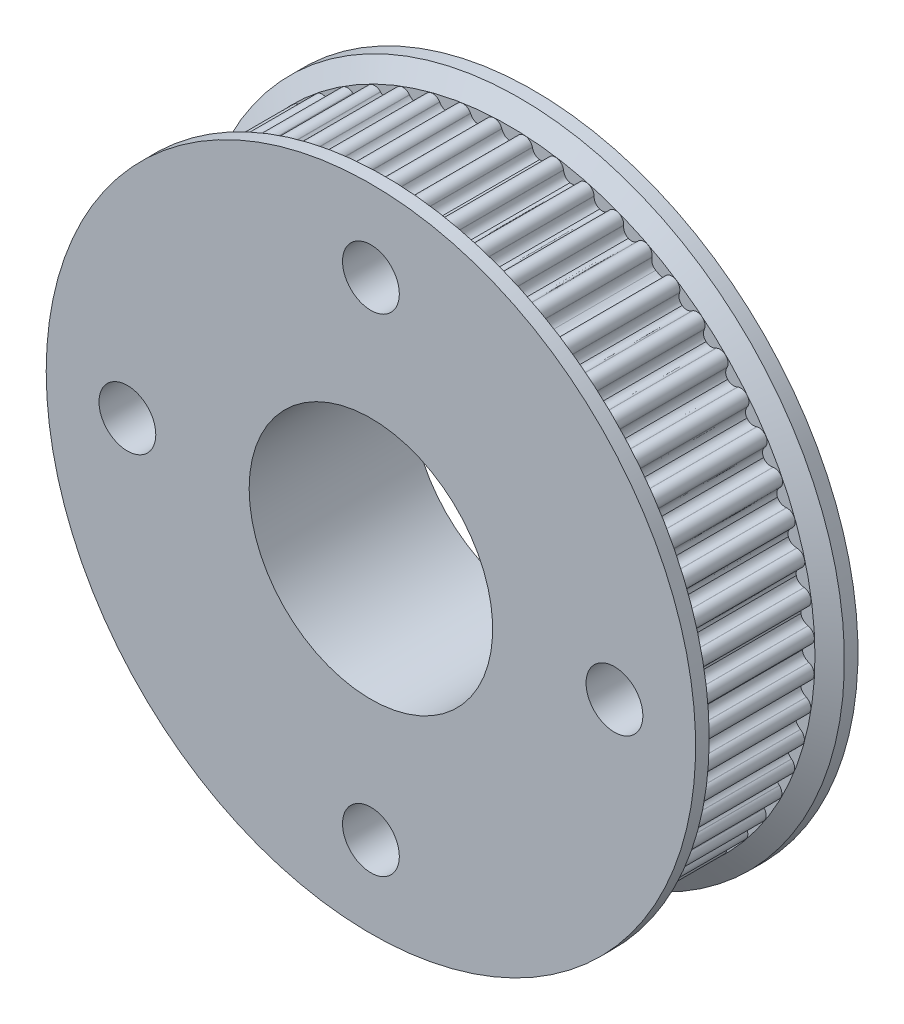
from build123d import *

# Parameters (mm, degrees)
SKETCH3_OUTSIDE_W  = 53.49
SKETCH3_OUTSIDE_H  = 53.49
CUT_EXTRUDE1_DEPTH = 7
SKETCH4_R          = 1.75
CUT_EXTRUDE2_DEPTH = 10
SKETCH5_R          = 3
CUT_EXTRUDE3_DEPTH = 3


with BuildPart() as part:
    # Sketch1 → Revolve1 (revolve)
    with BuildSketch(Plane(origin=(0, 0, 0), x_dir=(0, 0, -1), z_dir=(1, 0, 0)), mode=Mode.PRIVATE) as revolve1_sk:
        Polygon((0, 7.5), (0, 18.314101615), (0, 20), (-0.83604719, 20), (-1.5, 18.85), (-8.5, 18.85), (-9.16395281, 20), (-10, 20), (-10, 7.5), align=None)
    revolve(revolve1_sk.sketch.rotate(Axis((0, 0, 0), (0, 0, 1)), 90), axis=Axis((0, 0, 0), (0, 0, 1)))

    # Sketch3 outside → Cut-Extrude1 (cut)
    with BuildSketch(Plane.XY.offset(1.5)):
        Rectangle(SKETCH3_OUTSIDE_W, SKETCH3_OUTSIDE_H)
        with BuildLine():
            Line((0.48954913, 18.480375333), (0.485818632, 18.469717385))
            add(Edge.make_bspline(
                [(0.485818632, 18.469717385), (0.407741985, 18.249527558), (0.24028179, 18.086154527), (0.026214695, 18.085070307)],
                knots=[0, 0, 0, 0, 1, 1, 1, 1], degree=3))
            add(Edge.make_bspline(
                [(0.026214695, 18.085070307), (-0.187846082, 18.086775093), (-0.354832577, 18.250628249), (-0.432269829, 18.471041123)],
                knots=[0, 0, 0, 0, 1, 1, 1, 1], degree=3))
            Line((-0.432269829, 18.471041123), (-0.435971787, 18.481716895))
            ThreePointArc((-0.435971787, 18.481716895), (-0.931215069, 18.811965966), (-1.391421689, 18.434420969))
            Line((-1.391421689, 18.434420969), (-1.394049444, 18.423439012))
            add(Edge.make_bspline(
                [(-1.394049444, 18.423439012), (-1.451513615, 18.187532894), (-1.598236067, 18.015569009), (-1.838247448, 17.991333228)],
                knots=[0, 0, 0, 0, 1, 1, 1, 1], degree=3))
            add(Edge.make_bspline(
                [(-1.838247448, 17.991333228), (-2.078200755, 17.966529071), (-2.256668862, 18.105266918), (-2.36065454, 18.324677051)],
                knots=[0, 0, 0, 0, 1, 1, 1, 1], degree=3))
            Line((-2.36065454, 18.324677051), (-2.365448953, 18.334900655))
            ThreePointArc((-2.365448953, 18.334900655), (-2.892499669, 18.611573568), (-3.310721031, 18.187992112))
            Line((-3.310721031, 18.187992112), (-3.312186463, 18.176795639))
            add(Edge.make_bspline(
                [(-3.312186463, 18.176795639), (-3.344676936, 17.936175198), (-3.472620506, 17.749816677), (-3.70878375, 17.700625641)],
                knots=[0, 0, 0, 0, 1, 1, 1, 1], degree=3))
            add(Edge.make_bspline(
                [(-3.70878375, 17.700625641), (-3.944829828, 17.650875413), (-4.136822322, 17.770198244), (-4.26317296, 17.977536961)],
                knots=[0, 0, 0, 0, 1, 1, 1, 1], degree=3))
            Line((-4.26317296, 17.977536961), (-4.269009766, 17.987203407))
            ThreePointArc((-4.269009766, 17.987203407), (-4.822093437, 18.207268875), (-5.19374742, 17.742291806))
            Line((-5.19374742, 17.742291806), (-5.194034475, 17.73100349))
            add(Edge.make_bspline(
                [(-5.194034475, 17.73100349), (-5.201195276, 17.488305014), (-5.308958188, 17.289593639), (-5.538685842, 17.215986296)],
                knots=[0, 0, 0, 0, 1, 1, 1, 1], degree=3))
            add(Edge.make_bspline(
                [(-5.538685842, 17.215986296), (-5.76823852, 17.141835071), (-5.971651891, 17.240435558), (-6.118983164, 17.433431215)],
                knots=[0, 0, 0, 0, 1, 1, 1, 1], degree=3))
            Line((-6.118983164, 17.433431215), (-6.125798415, 17.442434594))
            ThreePointArc((-6.125798415, 17.442434594), (-6.698855341, 17.603481534), (-7.019870025, 17.102203239))
            Line((-7.019870025, 17.102203239), (-7.018975557, 17.090946756))
            add(Edge.make_bspline(
                [(-7.018975557, 17.090946756), (-7.000728232, 16.848829299), (-7.087129813, 16.639942195), (-7.307904932, 16.542725002)],
                knots=[0, 0, 0, 0, 1, 1, 1, 1], degree=3))
            add(Edge.make_bspline(
                [(-7.307904932, 16.542725002), (-7.528449183, 16.444985197), (-7.741054792, 16.521783053), (-7.907752509, 16.698321148)],
                knots=[0, 0, 0, 0, 1, 1, 1, 1], degree=3))
            Line((-7.907752509, 16.698321148), (-7.915471534, 16.706562818))
            ThreePointArc((-7.915471534, 16.706562818), (-8.502223183, 16.806826766), (-8.769081466, 16.274739354))
            Line((-8.769081466, 16.274739354), (-8.767015275, 16.263638033))
            add(Edge.make_bspline(
                [(-8.767015275, 16.263638033), (-8.723559745, 16.024754286), (-8.787653361, 15.807980062), (-8.997057087, 15.688218151)],
                knots=[0, 0, 0, 0, 1, 1, 1, 1], degree=3))
            add(Edge.make_bspline(
                [(-8.997057087, 15.688218151), (-9.206176582, 15.567960623), (-9.425645077, 15.622114435), (-9.609882862, 15.78026078)],
                knots=[0, 0, 0, 0, 1, 1, 1, 1], degree=3))
            Line((-9.609882862, 15.78026078), (-9.61842109, 15.787650443))
            ThreePointArc((-9.61842109, 15.787650443), (-10.212438889, 15.826032887), (-10.422217015, 15.268966019))
            Line((-10.422217015, 15.268966019), (-10.419001739, 15.258141488))
            add(Edge.make_bspline(
                [(-10.419001739, 15.258141488), (-10.350814112, 15.025108711), (-10.391897539, 14.802822392), (-10.587635602, 14.6618279)],
                knots=[0, 0, 0, 0, 1, 1, 1, 1], degree=3))
            add(Edge.make_bspline(
                [(-10.587635602, 14.6618279), (-10.783039184, 14.520370216), (-11.006966022, 14.551286663), (-11.206725327, 14.689308572)],
                knots=[0, 0, 0, 0, 1, 1, 1, 1], degree=3))
            Line((-11.206725327, 14.689308572), (-11.215989213, 14.695765267))
            ThreePointArc((-11.215989213, 14.695765267), (-11.810764978, 14.671845679), (-11.961164573, 14.095902697))
            Line((-11.961164573, 14.095902697), (-11.956835439, 14.085473551))
            add(Edge.make_bspline(
                [(-11.956835439, 14.085473551), (-11.864662793, 13.8608449), (-11.882285914, 13.635481902), (-12.062213765, 13.474799593)],
                knots=[0, 0, 0, 0, 1, 1, 1, 1], degree=3))
            add(Edge.make_bspline(
                [(-12.062213765, 13.474799593), (-12.241760551, 13.313691593), (-12.467692344, 13.321031948), (-12.680784565, 13.437417226)],
                knots=[0, 0, 0, 0, 1, 1, 1, 1], degree=3))
            Line((-12.680784565, 13.437417226), (-12.69067261, 13.442870211))
            ThreePointArc((-12.69067261, 13.442870211), (-13.279689854, 13.356910661), (-13.36906311, 12.768401715))
            Line((-13.36906311, 12.768401715), (-13.363667548, 12.75848222))
            add(Edge.make_bspline(
                [(-13.363667548, 12.75848222), (-13.248519746, 12.544718773), (-13.242489477, 12.318748218), (-13.404635791, 12.140138563)],
                knots=[0, 0, 0, 0, 1, 1, 1, 1], degree=3))
            add(Edge.make_bspline(
                [(-13.404635791, 12.140138563), (-13.566358629, 11.961145379), (-13.791820019, 11.94482922), (-14.015910473, 12.038302725)],
                knots=[0, 0, 0, 0, 1, 1, 1, 1], degree=3))
            Line((-14.015910473, 12.038302725), (-14.026314343, 12.042692255))
            ThreePointArc((-14.026314343, 12.042692255), (-14.603119668, 11.895634533), (-14.630487393, 11.301007453))
            Line((-14.630487393, 11.301007453), (-14.624084519, 11.291706287))
            add(Edge.make_bspline(
                [(-14.624084519, 11.291706287), (-14.487223144, 11.091150081), (-14.457605555, 10.867047752), (-14.600193821, 10.672467633)],
                knots=[0, 0, 0, 0, 1, 1, 1, 1], degree=3))
            add(Edge.make_bspline(
                [(-14.600193821, 10.672467633), (-14.742320842, 10.477550354), (-14.964841628, 10.437756444), (-15.197475133, 10.50729406)],
                knots=[0, 0, 0, 0, 1, 1, 1, 1], degree=3))
            Line((-15.197475133, 10.50729406), (-15.20828084, 10.510572043))
            ThreePointArc((-15.20828084, 10.510572043), (-15.766554648, 10.304027345), (-15.731616994, 9.709796987))
            Line((-15.731616994, 9.709796987), (-15.72427696, 9.701216057))
            add(Edge.make_bspline(
                [(-15.72427696, 9.701216057), (-15.567201493, 9.516064428), (-15.514321081, 9.296285636), (-15.635789073, 9.087866916)],
                knots=[0, 0, 0, 0, 1, 1, 1, 1], degree=3))
            add(Edge.make_bspline(
                [(-15.635789073, 9.087866916), (-15.756763103, 8.879161094), (-15.973905301, 8.816325423), (-16.212533075, 8.861165283)],
                knots=[0, 0, 0, 0, 1, 1, 1, 1], degree=3))
            Line((-16.212533075, 8.861165283), (-16.22362223, 8.863295805))
            ThreePointArc((-16.22362223, 8.863295805), (-16.757247956, 8.599527076), (-16.660387708, 8.012203954))
            Line((-16.660387708, 8.012203954), (-16.652190932, 8.004437273))
            add(Edge.make_bspline(
                [(-16.652190932, 8.004437273), (-16.476622326, 7.836718782), (-16.401058458, 7.623671469), (-16.500075347, 7.403697626)],
                knots=[0, 0, 0, 0, 1, 1, 1, 1], degree=3))
            add(Edge.make_bspline(
                [(-16.500075347, 7.403697626), (-16.598570971, 7.183489887), (-16.807955525, 7.098300897), (-17.049963113, 7.117951724)],
                knots=[0, 0, 0, 0, 1, 1, 1, 1], degree=3))
            Line((-17.049963113, 7.117951724), (-17.06121422, 7.118911443))
            ThreePointArc((-17.06121422, 7.118911443), (-17.564345349, 6.80080859), (-17.406623728, 6.226827538))
            Line((-17.406623728, 6.226827538), (-17.397660015, 6.2199602))
            add(Edge.make_bspline(
                [(-17.397660015, 6.2199602), (-17.205521836, 6.071512405), (-17.108102407, 5.867530763), (-17.183583343, 5.638411876)],
                knots=[0, 0, 0, 0, 1, 1, 1, 1], degree=3))
            add(Edge.make_bspline(
                [(-17.183583343, 5.638411876), (-17.258521421, 5.409114862), (-17.45785427, 5.3025059), (-17.700590186, 5.296752397)],
                knots=[0, 0, 0, 0, 1, 1, 1, 1], degree=3))
            Line((-17.700590186, 5.296752397), (-17.711879977, 5.296530797))
            ThreePointArc((-17.711879977, 5.296530797), (-18.179004098, 4.927579021), (-17.962149135, 4.373228696))
            Line((-17.962149135, 4.373228696), (-17.952516694, 4.367335942))
            add(Edge.make_bspline(
                [(-17.952516694, 4.367335942), (-17.745914049, 4.239785268), (-17.627706406, 4.047104161), (-17.678824405, 3.811350505)],
                knots=[0, 0, 0, 0, 1, 1, 1, 1], degree=3))
            add(Edge.make_bspline(
                [(-17.678824405, 3.811350505), (-17.729383899, 3.575476442), (-17.916481111, 3.448615539), (-18.157285889, 3.417520742)],
                knots=[0, 0, 0, 0, 1, 1, 1, 1], degree=3))
            Line((-18.157285889, 3.417520742), (-18.16849067, 3.416120252))
            ThreePointArc((-18.16849067, 3.416120252), (-18.594489874, 3.000361866), (-18.320877478, 2.471715846))
            Line((-18.320877478, 2.471715846), (-18.310681844, 2.466862237))
            add(Edge.make_bspline(
                [(-18.310681844, 2.466862237), (-18.091878313, 2.361606156), (-17.954177565, 2.18233664), (-17.980372566, 1.942531181)],
                knots=[0, 0, 0, 0, 1, 1, 1, 1], degree=3))
            add(Edge.make_bspline(
                [(-17.980372566, 1.942531181), (-18.005999537, 1.702664355), (-18.178811236, 1.556941425), (-18.415046569, 1.500846015)],
                knots=[0, 0, 0, 0, 1, 1, 1, 1], degree=3))
            Line((-18.415046569, 1.500846015), (-18.426043577, 1.498281978))
            ThreePointArc((-18.426043577, 1.498281978), (-18.806250528, 1.040272118), (-18.478878453, 0.543122359))
            Line((-18.478878453, 0.543122359), (-18.468231332, 0.539361073))
            add(Edge.make_bspline(
                [(-18.468231332, 0.539361073), (-18.239624173, 0.457552792), (-18.083938997, 0.293658981), (-18.084924003, 0.052429079)],
                knots=[0, 0, 0, 0, 1, 1, 1, 1], degree=3))
            add(Edge.make_bspline(
                [(-18.084924003, 0.052429079), (-18.085337676, -0.18880248), (-18.2419705, -0.351790866), (-18.471048144, -0.432272296)],
                knots=[0, 0, 0, 0, 1, 1, 1, 1], degree=3))
            Line((-18.471048144, -0.432272296), (-18.481716895, -0.435971787))
            ThreePointArc((-18.481716895, -0.435971787), (-18.811965966, -0.931215069), (-18.434420969, -1.391421689))
            Line((-18.434420969, -1.391421689), (-18.423439012, -1.394049444))
            add(Edge.make_bspline(
                [(-18.423439012, -1.394049444), (-18.187532894, -1.451513615), (-18.015569009, -1.598236067), (-17.991333228, -1.838247448)],
                knots=[0, 0, 0, 0, 1, 1, 1, 1], degree=3))
            add(Edge.make_bspline(
                [(-17.991333228, -1.838247448), (-17.966529071, -2.078200755), (-18.105266918, -2.256668862), (-18.324677051, -2.36065454)],
                knots=[0, 0, 0, 0, 1, 1, 1, 1], degree=3))
            Line((-18.324677051, -2.36065454), (-18.334900655, -2.365448953))
            ThreePointArc((-18.334900655, -2.365448953), (-18.611573568, -2.892499669), (-18.187992112, -3.310721031))
            Line((-18.187992112, -3.310721031), (-18.176795639, -3.312186463))
            add(Edge.make_bspline(
                [(-18.176795639, -3.312186463), (-17.936175198, -3.344676936), (-17.749816677, -3.472620506), (-17.700625641, -3.70878375)],
                knots=[0, 0, 0, 0, 1, 1, 1, 1], degree=3))
            add(Edge.make_bspline(
                [(-17.700625641, -3.70878375), (-17.650875413, -3.944829828), (-17.770198244, -4.136822322), (-17.977536961, -4.26317296)],
                knots=[0, 0, 0, 0, 1, 1, 1, 1], degree=3))
            Line((-17.977536961, -4.26317296), (-17.987203407, -4.269009766))
            ThreePointArc((-17.987203407, -4.269009766), (-18.207268875, -4.822093437), (-17.742291806, -5.19374742))
            Line((-17.742291806, -5.19374742), (-17.73100349, -5.194034475))
            add(Edge.make_bspline(
                [(-17.73100349, -5.194034475), (-17.488305014, -5.201195276), (-17.289593639, -5.308958188), (-17.215986296, -5.538685842)],
                knots=[0, 0, 0, 0, 1, 1, 1, 1], degree=3))
            add(Edge.make_bspline(
                [(-17.215986296, -5.538685842), (-17.141835071, -5.76823852), (-17.240435558, -5.971651891), (-17.433431215, -6.118983164)],
                knots=[0, 0, 0, 0, 1, 1, 1, 1], degree=3))
            Line((-17.433431215, -6.118983164), (-17.442434594, -6.125798415))
            ThreePointArc((-17.442434594, -6.125798415), (-17.603481534, -6.698855341), (-17.102203239, -7.019870025))
            Line((-17.102203239, -7.019870025), (-17.090946756, -7.018975557))
            add(Edge.make_bspline(
                [(-17.090946756, -7.018975557), (-16.848829299, -7.000728232), (-16.639942195, -7.087129813), (-16.542725002, -7.307904932)],
                knots=[0, 0, 0, 0, 1, 1, 1, 1], degree=3))
            add(Edge.make_bspline(
                [(-16.542725002, -7.307904932), (-16.444985197, -7.528449183), (-16.521783053, -7.741054792), (-16.698321148, -7.907752509)],
                knots=[0, 0, 0, 0, 1, 1, 1, 1], degree=3))
            Line((-16.698321148, -7.907752509), (-16.706562818, -7.915471534))
            ThreePointArc((-16.706562818, -7.915471534), (-16.806826766, -8.502223183), (-16.274739354, -8.769081466))
            Line((-16.274739354, -8.769081466), (-16.263638033, -8.767015275))
            add(Edge.make_bspline(
                [(-16.263638033, -8.767015275), (-16.024754286, -8.723559745), (-15.807980062, -8.787653361), (-15.688218151, -8.997057087)],
                knots=[0, 0, 0, 0, 1, 1, 1, 1], degree=3))
            add(Edge.make_bspline(
                [(-15.688218151, -8.997057087), (-15.567960623, -9.206176582), (-15.622114435, -9.425645077), (-15.78026078, -9.609882862)],
                knots=[0, 0, 0, 0, 1, 1, 1, 1], degree=3))
            Line((-15.78026078, -9.609882862), (-15.787650443, -9.61842109))
            ThreePointArc((-15.787650443, -9.61842109), (-15.826032887, -10.212438889), (-15.268966019, -10.422217015))
            Line((-15.268966019, -10.422217015), (-15.258141488, -10.419001739))
            add(Edge.make_bspline(
                [(-15.258141488, -10.419001739), (-15.025108711, -10.350814112), (-14.802822392, -10.391897539), (-14.6618279, -10.587635602)],
                knots=[0, 0, 0, 0, 1, 1, 1, 1], degree=3))
            add(Edge.make_bspline(
                [(-14.6618279, -10.587635602), (-14.520370216, -10.783039184), (-14.551286663, -11.006966022), (-14.689308572, -11.206725327)],
                knots=[0, 0, 0, 0, 1, 1, 1, 1], degree=3))
            Line((-14.689308572, -11.206725327), (-14.695765267, -11.215989213))
            ThreePointArc((-14.695765267, -11.215989213), (-14.671845679, -11.810764978), (-14.095902697, -11.961164573))
            Line((-14.095902697, -11.961164573), (-14.085473551, -11.956835439))
            add(Edge.make_bspline(
                [(-14.085473551, -11.956835439), (-13.8608449, -11.864662793), (-13.635481902, -11.882285914), (-13.474799593, -12.062213765)],
                knots=[0, 0, 0, 0, 1, 1, 1, 1], degree=3))
            add(Edge.make_bspline(
                [(-13.474799593, -12.062213765), (-13.313691593, -12.241760551), (-13.321031948, -12.467692344), (-13.437417226, -12.680784565)],
                knots=[0, 0, 0, 0, 1, 1, 1, 1], degree=3))
            Line((-13.437417226, -12.680784565), (-13.442870211, -12.69067261))
            ThreePointArc((-13.442870211, -12.69067261), (-13.356910661, -13.279689854), (-12.768401715, -13.36906311))
            Line((-12.768401715, -13.36906311), (-12.75848222, -13.363667548))
            add(Edge.make_bspline(
                [(-12.75848222, -13.363667548), (-12.544718773, -13.248519746), (-12.318748218, -13.242489477), (-12.140138563, -13.404635791)],
                knots=[0, 0, 0, 0, 1, 1, 1, 1], degree=3))
            add(Edge.make_bspline(
                [(-12.140138563, -13.404635791), (-11.961145379, -13.566358629), (-11.94482922, -13.791820019), (-12.038302725, -14.015910473)],
                knots=[0, 0, 0, 0, 1, 1, 1, 1], degree=3))
            Line((-12.038302725, -14.015910473), (-12.042692255, -14.026314343))
            ThreePointArc((-12.042692255, -14.026314343), (-11.895634533, -14.603119668), (-11.301007453, -14.630487393))
            Line((-11.301007453, -14.630487393), (-11.291706287, -14.624084519))
            add(Edge.make_bspline(
                [(-11.291706287, -14.624084519), (-11.091150081, -14.487223144), (-10.867047752, -14.457605555), (-10.672467633, -14.600193821)],
                knots=[0, 0, 0, 0, 1, 1, 1, 1], degree=3))
            add(Edge.make_bspline(
                [(-10.672467633, -14.600193821), (-10.477550354, -14.742320842), (-10.437756444, -14.964841628), (-10.50729406, -15.197475133)],
                knots=[0, 0, 0, 0, 1, 1, 1, 1], degree=3))
            Line((-10.50729406, -15.197475133), (-10.510572043, -15.20828084))
            ThreePointArc((-10.510572043, -15.20828084), (-10.304027345, -15.766554648), (-9.709796987, -15.731616994))
            Line((-9.709796987, -15.731616994), (-9.701216057, -15.72427696))
            add(Edge.make_bspline(
                [(-9.701216057, -15.72427696), (-9.516064428, -15.567201493), (-9.296285636, -15.514321081), (-9.087866916, -15.635789073)],
                knots=[0, 0, 0, 0, 1, 1, 1, 1], degree=3))
            add(Edge.make_bspline(
                [(-9.087866916, -15.635789073), (-8.879161094, -15.756763103), (-8.816325423, -15.973905301), (-8.861165283, -16.212533075)],
                knots=[0, 0, 0, 0, 1, 1, 1, 1], degree=3))
            Line((-8.861165283, -16.212533075), (-8.863295805, -16.22362223))
            ThreePointArc((-8.863295805, -16.22362223), (-8.599527076, -16.757247956), (-8.012203954, -16.660387708))
            Line((-8.012203954, -16.660387708), (-8.004437273, -16.652190932))
            add(Edge.make_bspline(
                [(-8.004437273, -16.652190932), (-7.836718782, -16.476622326), (-7.623671469, -16.401058458), (-7.403697626, -16.500075347)],
                knots=[0, 0, 0, 0, 1, 1, 1, 1], degree=3))
            add(Edge.make_bspline(
                [(-7.403697626, -16.500075347), (-7.183489887, -16.598570971), (-7.098300897, -16.807955525), (-7.117951724, -17.049963113)],
                knots=[0, 0, 0, 0, 1, 1, 1, 1], degree=3))
            Line((-7.117951724, -17.049963113), (-7.118911443, -17.06121422))
            ThreePointArc((-7.118911443, -17.06121422), (-6.80080859, -17.564345349), (-6.226827538, -17.406623728))
            Line((-6.226827538, -17.406623728), (-6.2199602, -17.397660015))
            add(Edge.make_bspline(
                [(-6.2199602, -17.397660015), (-6.071512405, -17.205521836), (-5.867530763, -17.108102407), (-5.638411876, -17.183583343)],
                knots=[0, 0, 0, 0, 1, 1, 1, 1], degree=3))
            add(Edge.make_bspline(
                [(-5.638411876, -17.183583343), (-5.409114862, -17.258521421), (-5.3025059, -17.45785427), (-5.296752397, -17.700590186)],
                knots=[0, 0, 0, 0, 1, 1, 1, 1], degree=3))
            Line((-5.296752397, -17.700590186), (-5.296530797, -17.711879977))
            ThreePointArc((-5.296530797, -17.711879977), (-4.927579021, -18.179004098), (-4.373228696, -17.962149135))
            Line((-4.373228696, -17.962149135), (-4.367335942, -17.952516694))
            add(Edge.make_bspline(
                [(-4.367335942, -17.952516694), (-4.239785268, -17.745914049), (-4.047104161, -17.627706406), (-3.811350505, -17.678824405)],
                knots=[0, 0, 0, 0, 1, 1, 1, 1], degree=3))
            add(Edge.make_bspline(
                [(-3.811350505, -17.678824405), (-3.575476442, -17.729383899), (-3.448615539, -17.916481111), (-3.417520742, -18.157285889)],
                knots=[0, 0, 0, 0, 1, 1, 1, 1], degree=3))
            Line((-3.417520742, -18.157285889), (-3.416120252, -18.16849067))
            ThreePointArc((-3.416120252, -18.16849067), (-3.000361866, -18.594489874), (-2.471715846, -18.320877478))
            Line((-2.471715846, -18.320877478), (-2.466862237, -18.310681844))
            add(Edge.make_bspline(
                [(-2.466862237, -18.310681844), (-2.361606156, -18.091878313), (-2.18233664, -17.954177565), (-1.942531181, -17.980372566)],
                knots=[0, 0, 0, 0, 1, 1, 1, 1], degree=3))
            add(Edge.make_bspline(
                [(-1.942531181, -17.980372566), (-1.702664355, -18.005999537), (-1.556941425, -18.178811236), (-1.500846015, -18.415046569)],
                knots=[0, 0, 0, 0, 1, 1, 1, 1], degree=3))
            Line((-1.500846015, -18.415046569), (-1.498281978, -18.426043577))
            ThreePointArc((-1.498281978, -18.426043577), (-1.040272118, -18.806250528), (-0.543122359, -18.478878453))
            Line((-0.543122359, -18.478878453), (-0.539361073, -18.468231332))
            add(Edge.make_bspline(
                [(-0.539361073, -18.468231332), (-0.457552792, -18.239624173), (-0.293658981, -18.083938997), (-0.052429079, -18.084924003)],
                knots=[0, 0, 0, 0, 1, 1, 1, 1], degree=3))
            add(Edge.make_bspline(
                [(-0.052429079, -18.084924003), (0.18880248, -18.085337676), (0.351790866, -18.2419705), (0.432272296, -18.471048144)],
                knots=[0, 0, 0, 0, 1, 1, 1, 1], degree=3))
            Line((0.432272296, -18.471048144), (0.435971787, -18.481716895))
            ThreePointArc((0.435971787, -18.481716895), (0.931215069, -18.811965966), (1.391421689, -18.434420969))
            Line((1.391421689, -18.434420969), (1.39404954, -18.423439036))
            add(Edge.make_bspline(
                [(1.39404954, -18.423439036), (1.451513615, -18.187532894), (1.598236067, -18.015569009), (1.838247448, -17.991333228)],
                knots=[0, 0, 0, 0, 1, 1, 1, 1], degree=3))
            add(Edge.make_bspline(
                [(1.838247448, -17.991333228), (2.078200755, -17.966529071), (2.256668862, -18.105266919), (2.36065454, -18.324677051)],
                knots=[0, 0, 0, 0, 1, 1, 1, 1], degree=3))
            Line((2.36065454, -18.324677051), (2.365448953, -18.334900655))
            ThreePointArc((2.365448953, -18.334900655), (2.892499669, -18.611573568), (3.310721031, -18.187992112))
            Line((3.310721031, -18.187992112), (3.312186562, -18.176795653))
            add(Edge.make_bspline(
                [(3.312186562, -18.176795653), (3.344676936, -17.936175198), (3.472620506, -17.749816677), (3.70878375, -17.700625641)],
                knots=[0, 0, 0, 0, 1, 1, 1, 1], degree=3))
            add(Edge.make_bspline(
                [(3.70878375, -17.700625641), (3.944829828, -17.650875413), (4.136822322, -17.770198244), (4.26317296, -17.977536961)],
                knots=[0, 0, 0, 0, 1, 1, 1, 1], degree=3))
            Line((4.26317296, -17.977536961), (4.269009766, -17.987203407))
            ThreePointArc((4.269009766, -17.987203407), (4.822093437, -18.207268875), (5.19374742, -17.742291806))
            Line((5.19374742, -17.742291806), (5.194034574, -17.731003493))
            add(Edge.make_bspline(
                [(5.194034574, -17.731003493), (5.201195276, -17.488305013), (5.308958188, -17.289593639), (5.538685842, -17.215986296)],
                knots=[0, 0, 0, 0, 1, 1, 1, 1], degree=3))
            add(Edge.make_bspline(
                [(5.538685842, -17.215986296), (5.76823852, -17.141835071), (5.971651891, -17.240435558), (6.118983164, -17.433431215)],
                knots=[0, 0, 0, 0, 1, 1, 1, 1], degree=3))
            Line((6.118983164, -17.433431215), (6.125798415, -17.442434594))
            ThreePointArc((6.125798415, -17.442434594), (6.698855341, -17.603481534), (7.019870025, -17.102203239))
            Line((7.019870025, -17.102203239), (7.018975656, -17.090946748))
            add(Edge.make_bspline(
                [(7.018975656, -17.090946748), (7.000728232, -16.848829299), (7.087129813, -16.639942195), (7.307904932, -16.542725002)],
                knots=[0, 0, 0, 0, 1, 1, 1, 1], degree=3))
            add(Edge.make_bspline(
                [(7.307904932, -16.542725002), (7.528449183, -16.444985197), (7.741054792, -16.521783053), (7.907752509, -16.698321148)],
                knots=[0, 0, 0, 0, 1, 1, 1, 1], degree=3))
            Line((7.907752509, -16.698321148), (7.915471534, -16.706562818))
            ThreePointArc((7.915471534, -16.706562818), (8.502223183, -16.806826766), (8.769081466, -16.274739354))
            Line((8.769081466, -16.274739354), (8.767015373, -16.263638015))
            add(Edge.make_bspline(
                [(8.767015373, -16.263638015), (8.723559745, -16.024754286), (8.787653361, -15.807980062), (8.997057087, -15.688218151)],
                knots=[0, 0, 0, 0, 1, 1, 1, 1], degree=3))
            add(Edge.make_bspline(
                [(8.997057087, -15.688218151), (9.206176582, -15.567960623), (9.425645077, -15.622114435), (9.609882862, -15.78026078)],
                knots=[0, 0, 0, 0, 1, 1, 1, 1], degree=3))
            Line((9.609882862, -15.78026078), (9.61842109, -15.787650443))
            ThreePointArc((9.61842109, -15.787650443), (10.212438889, -15.826032887), (10.422217015, -15.268966019))
            Line((10.422217015, -15.268966019), (10.419001834, -15.25814146))
            add(Edge.make_bspline(
                [(10.419001834, -15.25814146), (10.350814112, -15.025108711), (10.391897539, -14.802822392), (10.587635602, -14.6618279)],
                knots=[0, 0, 0, 0, 1, 1, 1, 1], degree=3))
            add(Edge.make_bspline(
                [(10.587635602, -14.6618279), (10.783039184, -14.520370216), (11.006966022, -14.551286663), (11.206725327, -14.689308572)],
                knots=[0, 0, 0, 0, 1, 1, 1, 1], degree=3))
            Line((11.206725327, -14.689308572), (11.215989213, -14.695765267))
            ThreePointArc((11.215989213, -14.695765267), (11.810764978, -14.671845679), (11.961164573, -14.095902697))
            Line((11.961164573, -14.095902697), (11.956835531, -14.085473514))
            add(Edge.make_bspline(
                [(11.956835531, -14.085473514), (11.864662793, -13.8608449), (11.882285914, -13.635481902), (12.062213765, -13.474799593)],
                knots=[0, 0, 0, 0, 1, 1, 1, 1], degree=3))
            add(Edge.make_bspline(
                [(12.062213765, -13.474799593), (12.241760551, -13.313691593), (12.467692344, -13.321031948), (12.680784565, -13.437417226)],
                knots=[0, 0, 0, 0, 1, 1, 1, 1], degree=3))
            Line((12.680784565, -13.437417226), (12.69067261, -13.442870211))
            ThreePointArc((12.69067261, -13.442870211), (13.279689854, -13.356910661), (13.36906311, -12.768401715))
            Line((13.36906311, -12.768401715), (13.363667636, -12.758482173))
            add(Edge.make_bspline(
                [(13.363667636, -12.758482173), (13.248519746, -12.544718773), (13.242489477, -12.318748218), (13.404635791, -12.140138563)],
                knots=[0, 0, 0, 0, 1, 1, 1, 1], degree=3))
            add(Edge.make_bspline(
                [(13.404635791, -12.140138563), (13.566358629, -11.961145379), (13.791820019, -11.94482922), (14.015910473, -12.038302725)],
                knots=[0, 0, 0, 0, 1, 1, 1, 1], degree=3))
            Line((14.015910473, -12.038302725), (14.026314343, -12.042692255))
            ThreePointArc((14.026314343, -12.042692255), (14.603119668, -11.895634533), (14.630487393, -11.301007453))
            Line((14.630487393, -11.301007453), (14.624084601, -11.291706231))
            add(Edge.make_bspline(
                [(14.624084601, -11.291706231), (14.487223144, -11.091150081), (14.457605555, -10.867047752), (14.600193821, -10.672467633)],
                knots=[0, 0, 0, 0, 1, 1, 1, 1], degree=3))
            add(Edge.make_bspline(
                [(14.600193821, -10.672467633), (14.742320842, -10.477550354), (14.964841628, -10.437756444), (15.197475133, -10.50729406)],
                knots=[0, 0, 0, 0, 1, 1, 1, 1], degree=3))
            Line((15.197475133, -10.50729406), (15.20828084, -10.510572043))
            ThreePointArc((15.20828084, -10.510572043), (15.766554648, -10.304027345), (15.731616994, -9.709796987))
            Line((15.731616994, -9.709796987), (15.724277035, -9.701215992))
            add(Edge.make_bspline(
                [(15.724277035, -9.701215992), (15.567201493, -9.516064428), (15.514321081, -9.296285636), (15.635789073, -9.087866916)],
                knots=[0, 0, 0, 0, 1, 1, 1, 1], degree=3))
            add(Edge.make_bspline(
                [(15.635789073, -9.087866916), (15.756763103, -8.879161094), (15.973905301, -8.816325423), (16.212533075, -8.861165283)],
                knots=[0, 0, 0, 0, 1, 1, 1, 1], degree=3))
            Line((16.212533075, -8.861165283), (16.22362223, -8.863295805))
            ThreePointArc((16.22362223, -8.863295805), (16.757247956, -8.599527076), (16.660387708, -8.012203954))
            Line((16.660387708, -8.012203954), (16.652191, -8.004437202))
            add(Edge.make_bspline(
                [(16.652191, -8.004437202), (16.476622326, -7.836718782), (16.401058458, -7.623671469), (16.500075347, -7.403697626)],
                knots=[0, 0, 0, 0, 1, 1, 1, 1], degree=3))
            add(Edge.make_bspline(
                [(16.500075347, -7.403697626), (16.598570971, -7.183489887), (16.807955525, -7.098300897), (17.049963113, -7.117951724)],
                knots=[0, 0, 0, 0, 1, 1, 1, 1], degree=3))
            Line((17.049963113, -7.117951724), (17.06121422, -7.118911443))
            ThreePointArc((17.06121422, -7.118911443), (17.564345349, -6.80080859), (17.406623728, -6.226827538))
            Line((17.406623728, -6.226827538), (17.397660075, -6.219960122))
            add(Edge.make_bspline(
                [(17.397660075, -6.219960122), (17.205521836, -6.071512405), (17.108102407, -5.867530763), (17.183583343, -5.638411876)],
                knots=[0, 0, 0, 0, 1, 1, 1, 1], degree=3))
            add(Edge.make_bspline(
                [(17.183583343, -5.638411876), (17.258521421, -5.409114862), (17.45785427, -5.3025059), (17.700590186, -5.296752397)],
                knots=[0, 0, 0, 0, 1, 1, 1, 1], degree=3))
            Line((17.700590186, -5.296752397), (17.711879977, -5.296530797))
            ThreePointArc((17.711879977, -5.296530797), (18.179004098, -4.927579021), (17.962149135, -4.373228696))
            Line((17.962149135, -4.373228696), (17.952516746, -4.367335857))
            add(Edge.make_bspline(
                [(17.952516746, -4.367335857), (17.745914049, -4.239785268), (17.627706406, -4.047104161), (17.678824405, -3.811350505)],
                knots=[0, 0, 0, 0, 1, 1, 1, 1], degree=3))
            add(Edge.make_bspline(
                [(17.678824405, -3.811350505), (17.729383899, -3.575476442), (17.916481111, -3.448615539), (18.157285889, -3.417520742)],
                knots=[0, 0, 0, 0, 1, 1, 1, 1], degree=3))
            Line((18.157285889, -3.417520742), (18.16849067, -3.416120252))
            ThreePointArc((18.16849067, -3.416120252), (18.594489874, -3.000361866), (18.320877478, -2.471715846))
            Line((18.320877478, -2.471715846), (18.310681887, -2.466862147))
            add(Edge.make_bspline(
                [(18.310681887, -2.466862147), (18.091878313, -2.361606156), (17.954177565, -2.18233664), (17.980372566, -1.942531181)],
                knots=[0, 0, 0, 0, 1, 1, 1, 1], degree=3))
            add(Edge.make_bspline(
                [(17.980372566, -1.942531181), (18.005999537, -1.702664355), (18.178811236, -1.556941425), (18.415046569, -1.500846015)],
                knots=[0, 0, 0, 0, 1, 1, 1, 1], degree=3))
            Line((18.415046569, -1.500846015), (18.426043577, -1.498281978))
            ThreePointArc((18.426043577, -1.498281978), (18.806250528, -1.040272118), (18.478878453, -0.543122359))
            Line((18.478878453, -0.543122359), (18.468231365, -0.539360979))
            add(Edge.make_bspline(
                [(18.468231365, -0.539360979), (18.239624173, -0.457552792), (18.083938997, -0.293658981), (18.084924003, -0.052429079)],
                knots=[0, 0, 0, 0, 1, 1, 1, 1], degree=3))
            add(Edge.make_bspline(
                [(18.084924003, -0.052429079), (18.085337676, 0.18880248), (18.2419705, 0.351790866), (18.471048144, 0.432272296)],
                knots=[0, 0, 0, 0, 1, 1, 1, 1], degree=3))
            Line((18.471048144, 0.432272296), (18.481716895, 0.435971787))
            ThreePointArc((18.481716895, 0.435971787), (18.811965966, 0.931215069), (18.434420969, 1.391421689))
            Line((18.434420969, 1.391421689), (18.423439036, 1.39404954))
            add(Edge.make_bspline(
                [(18.423439036, 1.39404954), (18.187532894, 1.451513615), (18.015569009, 1.598236067), (17.991333228, 1.838247448)],
                knots=[0, 0, 0, 0, 1, 1, 1, 1], degree=3))
            add(Edge.make_bspline(
                [(17.991333228, 1.838247448), (17.966529071, 2.078200755), (18.105266919, 2.256668862), (18.324677051, 2.36065454)],
                knots=[0, 0, 0, 0, 1, 1, 1, 1], degree=3))
            Line((18.324677051, 2.36065454), (18.334900655, 2.365448953))
            ThreePointArc((18.334900655, 2.365448953), (18.611573568, 2.892499669), (18.187992112, 3.310721031))
            Line((18.187992112, 3.310721031), (18.176795653, 3.312186562))
            add(Edge.make_bspline(
                [(18.176795653, 3.312186562), (17.936175198, 3.344676936), (17.749816677, 3.472620506), (17.700625641, 3.70878375)],
                knots=[0, 0, 0, 0, 1, 1, 1, 1], degree=3))
            add(Edge.make_bspline(
                [(17.700625641, 3.70878375), (17.650875413, 3.944829828), (17.770198244, 4.136822322), (17.977536961, 4.26317296)],
                knots=[0, 0, 0, 0, 1, 1, 1, 1], degree=3))
            Line((17.977536961, 4.26317296), (17.987203407, 4.269009766))
            ThreePointArc((17.987203407, 4.269009766), (18.207268875, 4.822093437), (17.742291806, 5.19374742))
            Line((17.742291806, 5.19374742), (17.731003493, 5.194034574))
            add(Edge.make_bspline(
                [(17.731003493, 5.194034574), (17.488305013, 5.201195276), (17.289593639, 5.308958188), (17.215986296, 5.538685842)],
                knots=[0, 0, 0, 0, 1, 1, 1, 1], degree=3))
            add(Edge.make_bspline(
                [(17.215986296, 5.538685842), (17.141835071, 5.76823852), (17.240435558, 5.971651891), (17.433431215, 6.118983164)],
                knots=[0, 0, 0, 0, 1, 1, 1, 1], degree=3))
            Line((17.433431215, 6.118983164), (17.442434594, 6.125798415))
            ThreePointArc((17.442434594, 6.125798415), (17.603481534, 6.698855341), (17.102203239, 7.019870025))
            Line((17.102203239, 7.019870025), (17.090946748, 7.018975656))
            add(Edge.make_bspline(
                [(17.090946748, 7.018975656), (16.848829299, 7.000728232), (16.639942195, 7.087129813), (16.542725002, 7.307904932)],
                knots=[0, 0, 0, 0, 1, 1, 1, 1], degree=3))
            add(Edge.make_bspline(
                [(16.542725002, 7.307904932), (16.444985197, 7.528449183), (16.521783053, 7.741054792), (16.698321148, 7.907752509)],
                knots=[0, 0, 0, 0, 1, 1, 1, 1], degree=3))
            Line((16.698321148, 7.907752509), (16.706562818, 7.915471534))
            ThreePointArc((16.706562818, 7.915471534), (16.806826766, 8.502223183), (16.274739354, 8.769081466))
            Line((16.274739354, 8.769081466), (16.263638015, 8.767015373))
            add(Edge.make_bspline(
                [(16.263638015, 8.767015373), (16.024754286, 8.723559745), (15.807980062, 8.787653361), (15.688218151, 8.997057087)],
                knots=[0, 0, 0, 0, 1, 1, 1, 1], degree=3))
            add(Edge.make_bspline(
                [(15.688218151, 8.997057087), (15.567960623, 9.206176582), (15.622114435, 9.425645077), (15.78026078, 9.609882862)],
                knots=[0, 0, 0, 0, 1, 1, 1, 1], degree=3))
            Line((15.78026078, 9.609882862), (15.787650443, 9.61842109))
            ThreePointArc((15.787650443, 9.61842109), (15.826032887, 10.212438889), (15.268966019, 10.422217015))
            Line((15.268966019, 10.422217015), (15.25814146, 10.419001834))
            add(Edge.make_bspline(
                [(15.25814146, 10.419001834), (15.025108711, 10.350814112), (14.802822392, 10.391897539), (14.6618279, 10.587635602)],
                knots=[0, 0, 0, 0, 1, 1, 1, 1], degree=3))
            add(Edge.make_bspline(
                [(14.6618279, 10.587635602), (14.520370216, 10.783039184), (14.551286663, 11.006966022), (14.689308572, 11.206725327)],
                knots=[0, 0, 0, 0, 1, 1, 1, 1], degree=3))
            Line((14.689308572, 11.206725327), (14.695765267, 11.215989213))
            ThreePointArc((14.695765267, 11.215989213), (14.671845679, 11.810764978), (14.095902697, 11.961164573))
            Line((14.095902697, 11.961164573), (14.085473514, 11.956835531))
            add(Edge.make_bspline(
                [(14.085473514, 11.956835531), (13.8608449, 11.864662793), (13.635481902, 11.882285914), (13.474799593, 12.062213765)],
                knots=[0, 0, 0, 0, 1, 1, 1, 1], degree=3))
            add(Edge.make_bspline(
                [(13.474799593, 12.062213765), (13.313691593, 12.241760551), (13.321031948, 12.467692344), (13.437417226, 12.680784565)],
                knots=[0, 0, 0, 0, 1, 1, 1, 1], degree=3))
            Line((13.437417226, 12.680784565), (13.442870211, 12.69067261))
            ThreePointArc((13.442870211, 12.69067261), (13.356910661, 13.279689854), (12.768401715, 13.36906311))
            Line((12.768401715, 13.36906311), (12.758482173, 13.363667636))
            add(Edge.make_bspline(
                [(12.758482173, 13.363667636), (12.544718773, 13.248519746), (12.318748218, 13.242489477), (12.140138563, 13.404635791)],
                knots=[0, 0, 0, 0, 1, 1, 1, 1], degree=3))
            add(Edge.make_bspline(
                [(12.140138563, 13.404635791), (11.961145379, 13.566358629), (11.94482922, 13.791820019), (12.038302725, 14.015910473)],
                knots=[0, 0, 0, 0, 1, 1, 1, 1], degree=3))
            Line((12.038302725, 14.015910473), (12.042692255, 14.026314343))
            ThreePointArc((12.042692255, 14.026314343), (11.895634533, 14.603119668), (11.301007453, 14.630487393))
            Line((11.301007453, 14.630487393), (11.291706231, 14.624084601))
            add(Edge.make_bspline(
                [(11.291706231, 14.624084601), (11.091150081, 14.487223144), (10.867047752, 14.457605555), (10.672467633, 14.600193821)],
                knots=[0, 0, 0, 0, 1, 1, 1, 1], degree=3))
            add(Edge.make_bspline(
                [(10.672467633, 14.600193821), (10.477550354, 14.742320842), (10.437756444, 14.964841628), (10.50729406, 15.197475133)],
                knots=[0, 0, 0, 0, 1, 1, 1, 1], degree=3))
            Line((10.50729406, 15.197475133), (10.510572043, 15.20828084))
            ThreePointArc((10.510572043, 15.20828084), (10.304027345, 15.766554648), (9.709796987, 15.731616994))
            Line((9.709796987, 15.731616994), (9.701215992, 15.724277035))
            add(Edge.make_bspline(
                [(9.701215992, 15.724277035), (9.516064428, 15.567201493), (9.599334459, 15.33876957), (9.0425, 15.662069427)],
                knots=[0, 0, 0, 0, 1, 1, 1, 1], degree=3))
            add(Edge.make_bspline(
                [(9.0425, 15.662069427), (8.833444347, 15.782437904), (8.769979438, 15.999397026), (8.814127318, 16.23815379)],
                knots=[0, 0, 0, 0, 1, 1, 1, 1], degree=3))
            Line((8.814127318, 16.23815379), (8.816225683, 16.249249075))
            ThreePointArc((8.816225683, 16.249249075), (8.550911063, 16.782107883), (7.96387121, 16.683545371))
            Line((7.96387121, 16.683545371), (7.956128252, 16.675326181))
            add(Edge.make_bspline(
                [(7.956128252, 16.675326181), (7.788919518, 16.499272023), (7.576092163, 16.423090841), (7.35583219, 16.521469601)],
                knots=[0, 0, 0, 0, 1, 1, 1, 1], degree=3))
            add(Edge.make_bspline(
                [(7.35583219, 16.521469601), (7.135339834, 16.619326421), (7.049544188, 16.828463129), (7.068493344, 17.070526668)],
                knots=[0, 0, 0, 0, 1, 1, 1, 1], degree=3))
            Line((7.068493344, 17.070526668), (7.069420441, 17.081780511))
            ThreePointArc((7.069420441, 17.081780511), (6.74986033, 17.583987333), (6.176338931, 17.424602383))
            Line((6.176338931, 17.424602383), (6.169497529, 17.415618859))
            add(Edge.make_bspline(
                [(6.169497529, 17.415618859), (6.021607452, 17.223051072), (5.817909089, 17.125040702), (5.588572343, 17.199857097)],
                knots=[0, 0, 0, 0, 1, 1, 1, 1], degree=3))
            add(Edge.make_bspline(
                [(5.588572343, 17.199857097), (5.359059045, 17.274130119), (5.251872657, 17.473153068), (5.245415478, 17.715871284)],
                knots=[0, 0, 0, 0, 1, 1, 1, 1], degree=3))
            Line((5.245415478, 17.715871284), (5.24516115, 17.727160385))
            ThreePointArc((5.24516115, 17.727160385), (4.874856715, 18.193212938), (4.32113739, 17.974751805))
            Line((4.32113739, 17.974751805), (4.3152725, 17.965102373))
            add(Edge.make_bspline(
                [(4.3152725, 17.965102373), (4.188321395, 17.75813077), (3.995983787, 17.639365034), (3.760082928, 17.689799359)],
                knots=[0, 0, 0, 0, 1, 1, 1, 1], degree=3))
            add(Edge.make_bspline(
                [(3.760082928, 17.689799359), (3.524063283, 17.739674834), (3.396660511, 17.926403485), (3.364867742, 18.167117107)],
                knots=[0, 0, 0, 0, 1, 1, 1, 1], degree=3))
            Line((3.364867742, 18.167117107), (3.363434775, 18.17831778))
            ThreePointArc((3.363434775, 18.17831778), (2.946443149, 18.603109895), (2.418592563, 18.327966085))
            Line((2.418592563, 18.327966085), (2.413768442, 18.317756465))
            add(Edge.make_bspline(
                [(2.413768442, 18.317756465), (2.309147212, 18.09864867), (2.130277649, 17.960428791), (1.890397258, 17.985928478)],
                knots=[0, 0, 0, 0, 1, 1, 1, 1], degree=3))
            add(Edge.make_bspline(
                [(1.890397258, 17.985928478), (1.650457146, 18.010859958), (1.504233841, 18.183248475), (1.447453812, 18.419320192)],
                knots=[0, 0, 0, 0, 1, 1, 1, 1], degree=3))
            Line((1.447453812, 18.419320192), (1.444857905, 18.430309721))
            ThreePointArc((1.444857905, 18.430309721), (0.985747736, 18.809187287), (0.48954913, 18.480375333))
        make_face(mode=Mode.SUBTRACT)
    extrude(amount=CUT_EXTRUDE1_DEPTH, mode=Mode.SUBTRACT)

    # Sketch4 → Cut-Extrude2 (cut)
    with BuildSketch(Plane.XY.offset(10)):
        with Locations((0, 15)):
            Circle(SKETCH4_R)
        with Locations((15, 0)):
            Circle(SKETCH4_R)
        with Locations((0, -15)):
            Circle(SKETCH4_R)
        with Locations((-15, 0)):
            Circle(SKETCH4_R)
    extrude(amount=-CUT_EXTRUDE2_DEPTH, mode=Mode.SUBTRACT)

    # Sketch5 → Cut-Extrude3 (cut)
    with BuildSketch(Plane(origin=(0, 0, 0), x_dir=(-1, 0, 0), z_dir=(0, 0, -1))):
        with Locations((0, 15)):
            Circle(SKETCH5_R)
        with Locations((15, 0)):
            Circle(SKETCH5_R)
        with Locations((0, -15)):
            Circle(SKETCH5_R)
        with Locations((-15, 0)):
            Circle(SKETCH5_R)
    extrude(amount=-CUT_EXTRUDE3_DEPTH, mode=Mode.SUBTRACT)


solid = part.part
